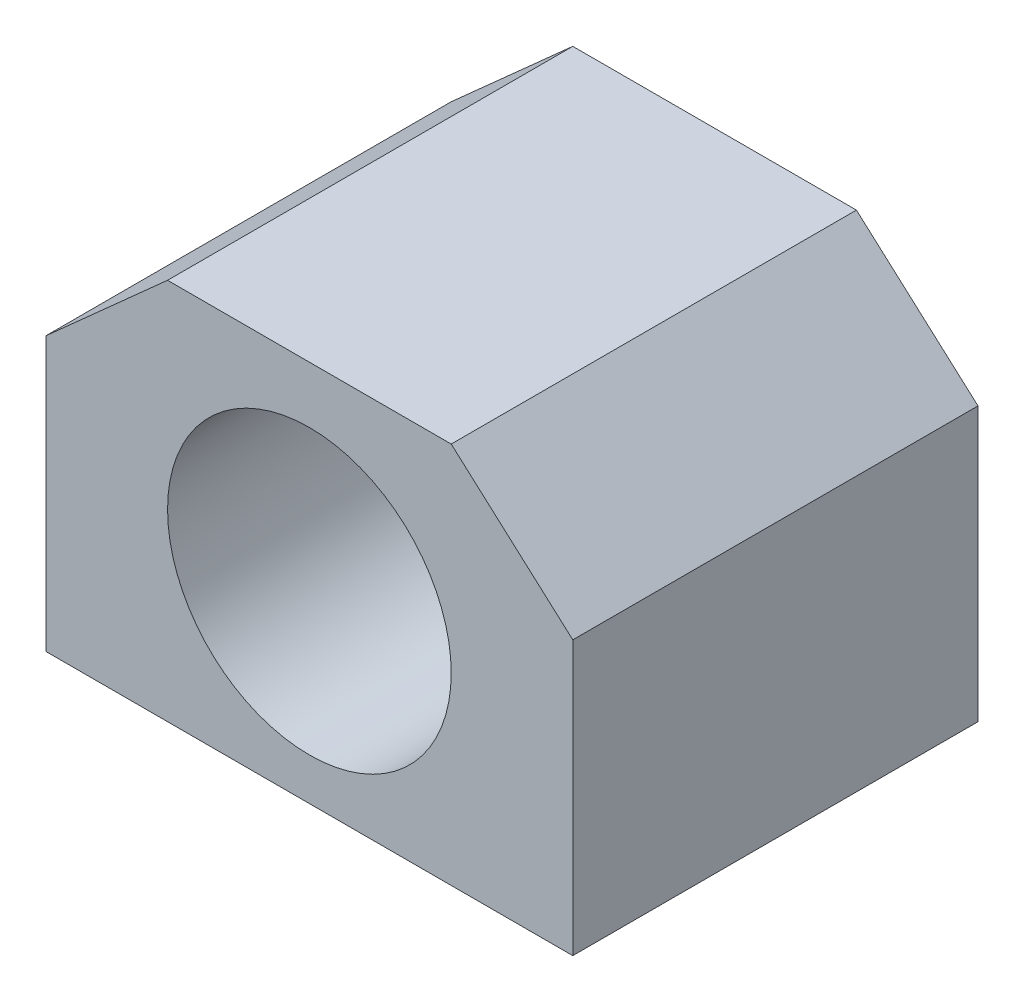
from build123d import *

# Parameters (mm, degrees)
SKETCH1_R           = 14
BOSS_EXTRUDE1_DEPTH = 40
SKETCH2_R           = 2
CUT_EXTRUDE1_DEPTH  = 10


with BuildPart() as part:
    # Sketch1 → Boss-Extrude1 (new body)
    with BuildSketch(Plane.XY):
        Polygon((0, 0), (52, 0), (52, 27), (40, 37.737759826), (12, 37.737759826), (0, 27), align=None)
        with Locations((26, 18.157759826)):
            Circle(SKETCH1_R, mode=Mode.SUBTRACT)
    extrude(amount=BOSS_EXTRUDE1_DEPTH)

    # Sketch2 → Cut-Extrude1 (cut)
    with BuildSketch(Plane.XZ):
        with Locations(Location((6, 34, 0), (0, 0, 270))):
            Circle(SKETCH2_R)
        with Locations(Location((46, 34, 0), (0, 0, 270))):
            Circle(SKETCH2_R)
        with Locations(Location((6, 6, 0), (0, 0, 270))):
            Circle(SKETCH2_R)
        with Locations(Location((46, 6, 0), (0, 0, 270))):
            Circle(SKETCH2_R)
    extrude(amount=-CUT_EXTRUDE1_DEPTH, mode=Mode.SUBTRACT)


solid = part.part
